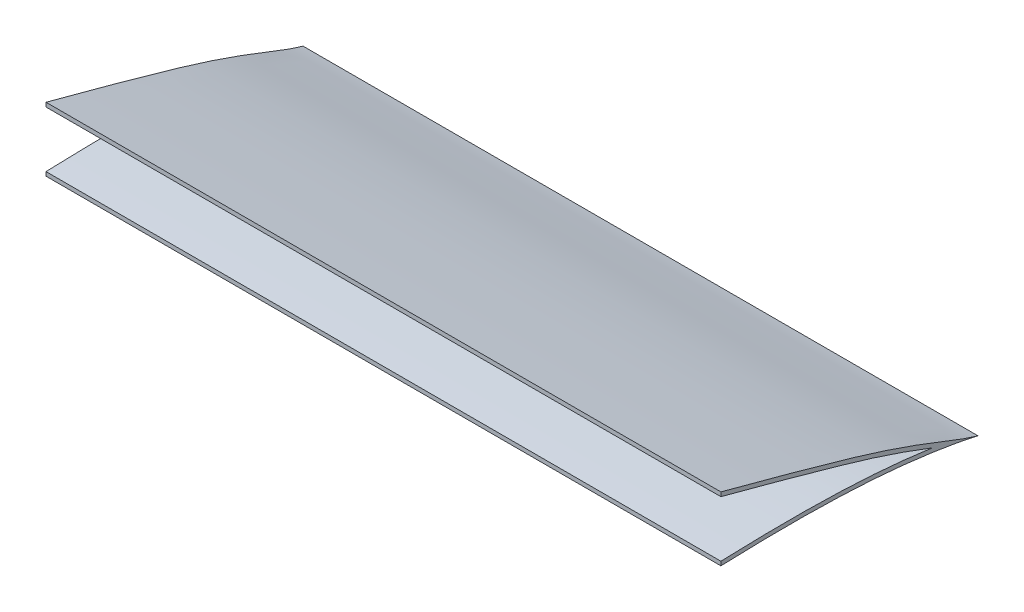
from build123d import *

# Parameters (mm, degrees)
BOSS_EXTRUDE1_DEPTH = 266.7


with BuildPart() as part:
    # Sketch1 → Boss-Extrude1 (new body)
    with BuildSketch(Plane(origin=(0, 0, 0), x_dir=(0, 0, -1), z_dir=(1, 0, 0))):
        with BuildLine():
            add(Edge.make_bspline(
                [(802.151053399, -28.011732033), (801.137231832, -27.710542124), (797.278434829, -26.564156251), (789.357225956, -23.458600593), (777.06146068, -18.643579076), (760.581722214, -13.040064966), (739.99675031, -7.1233282), (719.536621399, -1.473225419), (705.942548139, 2.160117841), (700.551053399, 3.586222224)],
                knots=[0, 0, 0, 0, 0.003802345, 0.014472446, 0.030563625, 0.051299059, 0.07702847, 0.107573811, 0.12762815, 0.12762815, 0.12762815, 0.12762815], degree=3))
            Line((700.551053399, 3.586222224), (700.551053399, 1.94501203))
            add(Edge.make_bspline(
                [(784.106482277, -23.118423177), (780.160330067, -21.594194865), (772.229019431, -18.642031364), (760.174514143, -14.672159257), (747.991113763, -11.061270892), (731.645658465, -6.455954447), (715.833787739, -2.121810728), (704.090889496, 1.008206045), (700.551053399, 1.94501203)],
                knots=[0.02229965, 0.02229965, 0.02229965, 0.02229965, 0.037574888, 0.052850126, 0.068125363, 0.083400601, 0.113951077, 0.127124743, 0.127124743, 0.127124743, 0.127124743], degree=3))
            add(Edge.make_bspline(
                [(700.551053399, -20.137154854), (702.237235016, -20.07278821), (712.644392858, -19.707648591), (731.789031329, -19.412207677), (758.000345874, -20.150218902), (775.446944988, -21.867269156), (784.106482277, -23.118423177)],
                knots=[0.880649492, 0.880649492, 0.880649492, 0.880649492, 0.886560878, 0.917129102, 0.947697327, 0.978265551, 0.978265551, 0.978265551, 0.978265551], degree=3))
            Line((700.551053399, -20.137154854), (700.551053399, -21.725128402))
            add(Edge.make_bspline(
                [(700.551053399, -21.725128402), (707.310876378, -21.467104601), (723.70310591, -21.047863858), (747.830287498, -21.278636312), (770.688405743, -22.854711922), (787.091395164, -25.07351564), (796.842303095, -26.819328187), (801.097715575, -27.775140745), (802.151053399, -28.011732033)],
                knots=[0.880578814, 0.880578814, 0.880578814, 0.880578814, 0.904323704, 0.938131581, 0.965241743, 0.984690447, 0.996210442, 1, 1, 1, 1], degree=3))
        make_face()
    extrude(amount=BOSS_EXTRUDE1_DEPTH)


solid = part.part
